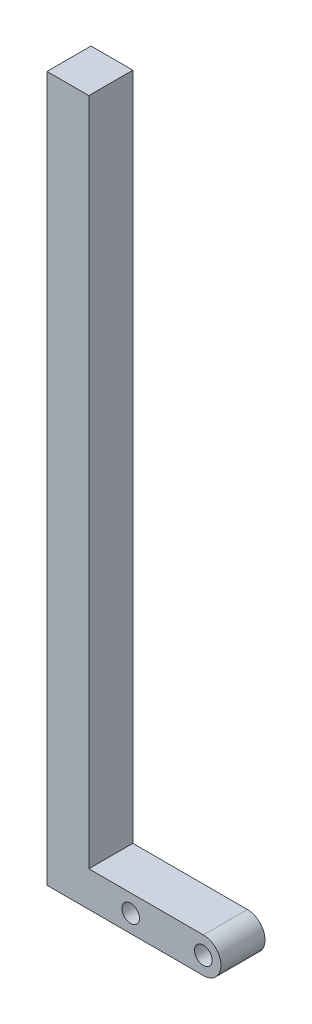
from build123d import *

# Parameters (mm, degrees)
SKETCH_1_R      = 1
EXTRUDE_1_DEPTH = 5


with BuildPart() as part:
    # 草图1 → 凸台-拉伸1 (new body)
    with BuildSketch(Plane.XY):
        with BuildLine():
            Line((0, 2), (8.25, 2))
            ThreePointArc((8.25, 2), (10.25, 0), (8.25, -2))
            Line((8.25, -2), (-0.5, -2))
            Line((-0.5, -2), (-9.5, -2))
            Line((-9.5, -2), (-9.5, 78))
            Line((-9.5, 78), (-4.75, 78))
            Line((-4.75, 78), (-4.75, 2))
            Line((-4.75, 2), (0, 2))
        make_face()
        Circle(SKETCH_1_R, mode=Mode.SUBTRACT)
        with Locations((8.25, 0)):
            Circle(SKETCH_1_R, mode=Mode.SUBTRACT)
    extrude(amount=EXTRUDE_1_DEPTH)


solid = part.part
